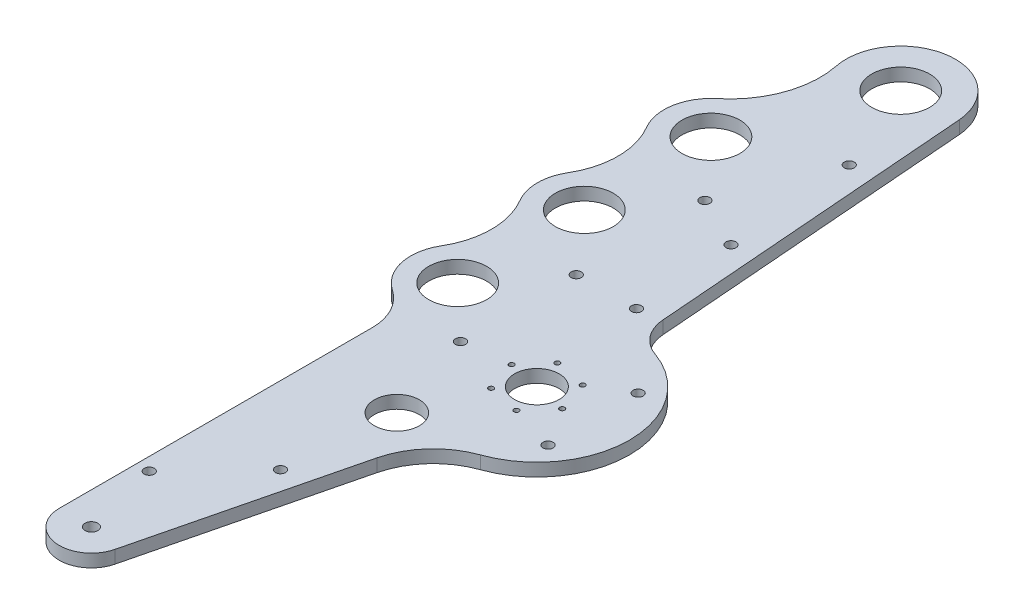
from build123d import *

# Parameters (mm, degrees)
SKETCH2_R           = 14.2875
SKETCH2_R_2         = 3.175
SKETCH2_R_3         = 11.000000098
SKETCH2_R_4         = 11.1125
BOSS_EXTRUDE1_DEPTH = 6.35
CUT_EXTRUDE1_DEPTH  = 432.327965994
SKETCH4_R           = 2.4892
CUT_EXTRUDE2_DEPTH  = 432.327965994


with BuildPart() as part:
    # Sketch2 → Boss-Extrude1 (new body)
    with BuildSketch(Plane(origin=(0, 0, 0), x_dir=(1, 0, 0), z_dir=(0, 1, 0))):
        with BuildLine():
            Line((239.638116078, 289.551831635), (252.063037476, 130.700241744))
            ThreePointArc((252.063037476, 130.700241744), (255.941769276, 120.588679828), (264.705030265, 114.225229381))
            ThreePointArc((264.705030265, 114.225229381), (295.185030265, 71.12), (264.705030265, 28.014770619))
            ThreePointArc((264.705030265, 28.014770619), (249.169215503, 17.673987821), (240.408185929, 1.19558711))
            Line((240.408185929, 1.19558711), (214.878590493, -102.576218058))
            ThreePointArc((214.878590493, -102.576218058), (197.553145093, -114.543453333), (183.588238686, -98.783784318))
            Line((183.588238686, -98.783784318), (183.588238686, 55.786275092))
            ThreePointArc((183.588238686, 55.786275092), (180.651328593, 67.642479874), (172.519766888, 76.756904539))
            ThreePointArc((172.519766888, 76.756904539), (162.968469926, 90.879304348), (165.661306265, 107.714329816))
            ThreePointArc((165.661306265, 107.714329816), (170.989832116, 127.147303909), (165.661306265, 146.580278002))
            ThreePointArc((165.661306265, 146.580278002), (162.419786372, 158.402003909), (165.661306265, 170.223729816))
            ThreePointArc((165.661306265, 170.223729816), (170.989832116, 189.656703909), (165.661306265, 209.089678002))
            ThreePointArc((165.661306265, 209.089678002), (162.771672921, 224.934819973), (170.904796514, 238.837007052))
            ThreePointArc((170.904796514, 238.837007052), (184.60593815, 258.315476471), (186.286318241, 282.07065224))
            ThreePointArc((186.286318241, 282.07065224), (208.98517415, 314.173400291), (239.638116078, 289.551831635))
        make_face()
        with Locations(Location((185.597286372, 95.892603909, 0), (0, 0, 270))):
            Circle(SKETCH2_R, mode=Mode.SUBTRACT)
        with Locations(Location((185.597286372, 158.402003909, 0), (0, 0, 270))):
            Circle(SKETCH2_R, mode=Mode.SUBTRACT)
        with Locations(Location((185.597286372, 220.911403909, 0), (0, 0, 270))):
            Circle(SKETCH2_R, mode=Mode.SUBTRACT)
        with Locations(Location((212.73279296, 287.447373473, 0), (0, 0, 270))):
            Circle(SKETCH2_R, mode=Mode.SUBTRACT)
        with Locations(Location((199.463238686, -98.783784318, 0), (0, 0, 270))):
            Circle(SKETCH2_R_2, mode=Mode.SUBTRACT)
        with Locations(Location((249.465030265, 71.12, 0), (0, 0, 270))):
            Circle(SKETCH2_R_3, mode=Mode.SUBTRACT)
        with Locations(Location((226.06, 25.4, 0), (0, 0, 270))):
            Circle(SKETCH2_R_4, mode=Mode.SUBTRACT)
    extrude(amount=BOSS_EXTRUDE1_DEPTH)

    # Sketch3 → Cut-Extrude1 (cut, through all)
    with BuildSketch(Plane(origin=(0, 6.35, 0), x_dir=(1, 0, 0), z_dir=(0, 1, 0))):
        with BuildLine():
            ThreePointArc((233.536357361, 73.079561051), (235.010141069, 74.055758562), (234.033943558, 75.529542271))
            ThreePointArc((234.033943558, 75.529542271), (232.56015985, 74.553344759), (233.536357361, 73.079561051))
        make_face()
        with BuildLine():
            ThreePointArc((254.795860629, 57.173540539), (253.32207692, 56.197343028), (254.298274432, 54.72355932))
            ThreePointArc((254.298274432, 54.72355932), (255.77205814, 55.699756831), (254.795860629, 57.173540539))
        make_face()
        with BuildLine():
            ThreePointArc((264.896116972, 66.710457729), (266.369900681, 67.686655241), (265.393703169, 69.160438949))
            ThreePointArc((265.393703169, 69.160438949), (263.919919461, 68.184241438), (264.896116972, 66.710457729))
        make_face()
        with BuildLine():
            ThreePointArc((259.814079708, 81.8819078), (261.287863416, 82.858105311), (260.311665905, 84.331889019))
            ThreePointArc((260.311665905, 84.331889019), (258.837882196, 83.355691508), (259.814079708, 81.8819078))
        make_face()
        with BuildLine():
            ThreePointArc((244.134199902, 85.066459461), (245.60798361, 86.042656972), (244.631786099, 87.51644068))
            ThreePointArc((244.631786099, 87.51644068), (243.158002391, 86.540243169), (244.134199902, 85.066459461))
        make_face()
        with BuildLine():
            ThreePointArc((239.115980823, 60.3580922), (237.642197115, 59.381894689), (238.618394626, 57.908110981))
            ThreePointArc((238.618394626, 57.908110981), (240.092178334, 58.884308492), (239.115980823, 60.3580922))
        make_face()
    extrude(amount=-CUT_EXTRUDE1_DEPTH, mode=Mode.SUBTRACT)

    # Sketch4 → Cut-Extrude2 (cut, through all)
    with BuildSketch(Plane(origin=(0, 6.35, 0), x_dir=(1, 0, 0), z_dir=(0, 1, 0))):
        with Locations(Location((231.78279296, 242.997373473, 0), (0, 0, 270))):
            Circle(SKETCH4_R)
        with Locations(Location((211.334459224, 192.197373473, 0), (0, 0, 270))):
            Circle(SKETCH4_R)
        with Locations(Location((236.734459224, 179.690730842, 0), (0, 0, 270))):
            Circle(SKETCH4_R)
        with Locations(Location((211.334459224, 128.697373473, 0), (0, 0, 270))):
            Circle(SKETCH4_R)
        with Locations(Location((211.334459224, 71.547373473, 0), (0, 0, 270))):
            Circle(SKETCH4_R)
        with Locations(Location((221.688238686, -27.663784318, 0), (0, 0, 270))):
            Circle(SKETCH4_R)
        with Locations(Location((189.938238686, -60.683784318, 0), (0, 0, 270))):
            Circle(SKETCH4_R)
        with Locations(Location((277.224046368, 93.345, 0), (0, 0, 270))):
            Circle(SKETCH4_R)
        with Locations(Location((277.224046368, 48.895, 0), (0, 0, 270))):
            Circle(SKETCH4_R)
        with Locations(Location((240.695792235, 129.045416737, 0), (0, 0, 270))):
            Circle(SKETCH4_R)
    extrude(amount=-CUT_EXTRUDE2_DEPTH, mode=Mode.SUBTRACT)


solid = part.part
